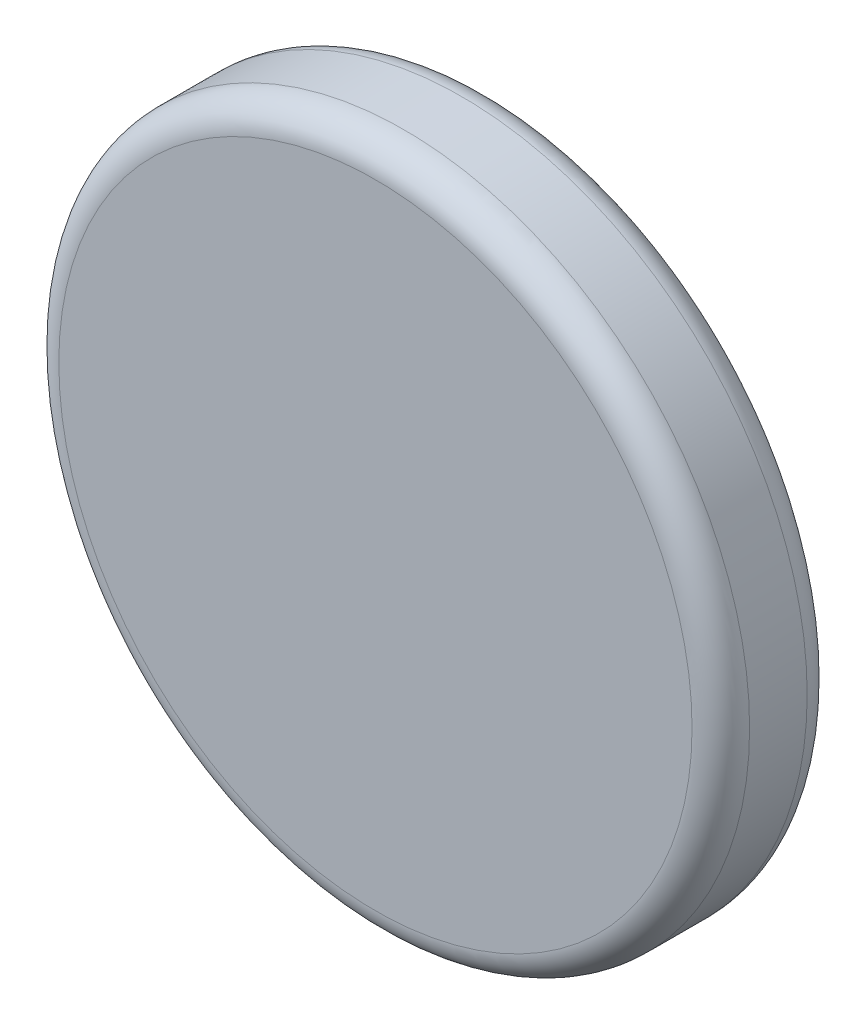
from build123d import *

# Parameters (mm, degrees)
SKETCH_1_R      = 120
EXTRUDE_1_DEPTH = 40
FILLET_1_R      = 10


with BuildPart() as part:
    # 草图1 → 凸台-拉伸1 (new body)
    with BuildSketch(Plane.XY):
        Circle(SKETCH_1_R)
    extrude(amount=EXTRUDE_1_DEPTH)

    # 圆角1
    fillet_1_edges = [part.edges().sort_by_distance(p)[0] for p in [
        (-120, 0, 0),
        (-120, 0, 40),
    ]]
    fillet(fillet_1_edges, radius=FILLET_1_R)


solid = part.part
